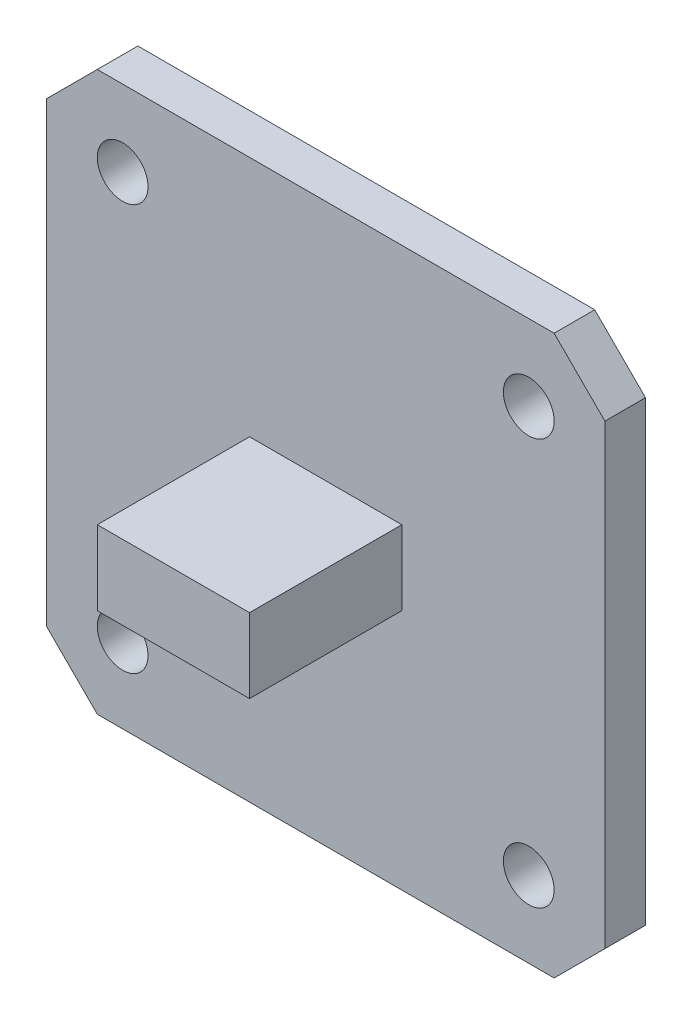
from build123d import *

# Parameters (mm, degrees)
ESQUISSE1_R        = 1.5
BOSS_EXTRU_1_DEPTH = 2.4
ESQUISSE2_W        = 9
ESQUISSE2_H        = 4.4
BOSS_EXTRU_2_DEPTH = 9


with BuildPart() as part:
    # Esquisse1 → Boss.-Extru.1 (new body)
    with BuildSketch(Plane.XY):
        Polygon((0, 30), (0, 3), (3, 0), (30, 0), (33, 3), (33, 30), (30, 33), (3, 33), align=None)
        with Locations((4.5, 28.5)):
            Circle(ESQUISSE1_R, mode=Mode.SUBTRACT)
        with Locations(Location((28.5, 28.5, 0), (0, 0, 180))):
            Circle(ESQUISSE1_R, mode=Mode.SUBTRACT)
        with Locations(Location((4.5, 4.5, 0), (0, 0, 180))):
            Circle(ESQUISSE1_R, mode=Mode.SUBTRACT)
        with Locations((28.5, 4.5)):
            Circle(ESQUISSE1_R, mode=Mode.SUBTRACT)
    extrude(amount=BOSS_EXTRU_1_DEPTH)

    # Esquisse2 → Boss.-Extru.2 (add)
    with BuildSketch(Plane.XY.offset(2.4)):
        with Locations((16.5, 16.5)):
            Rectangle(ESQUISSE2_W, ESQUISSE2_H)
    extrude(amount=BOSS_EXTRU_2_DEPTH)


solid = part.part
